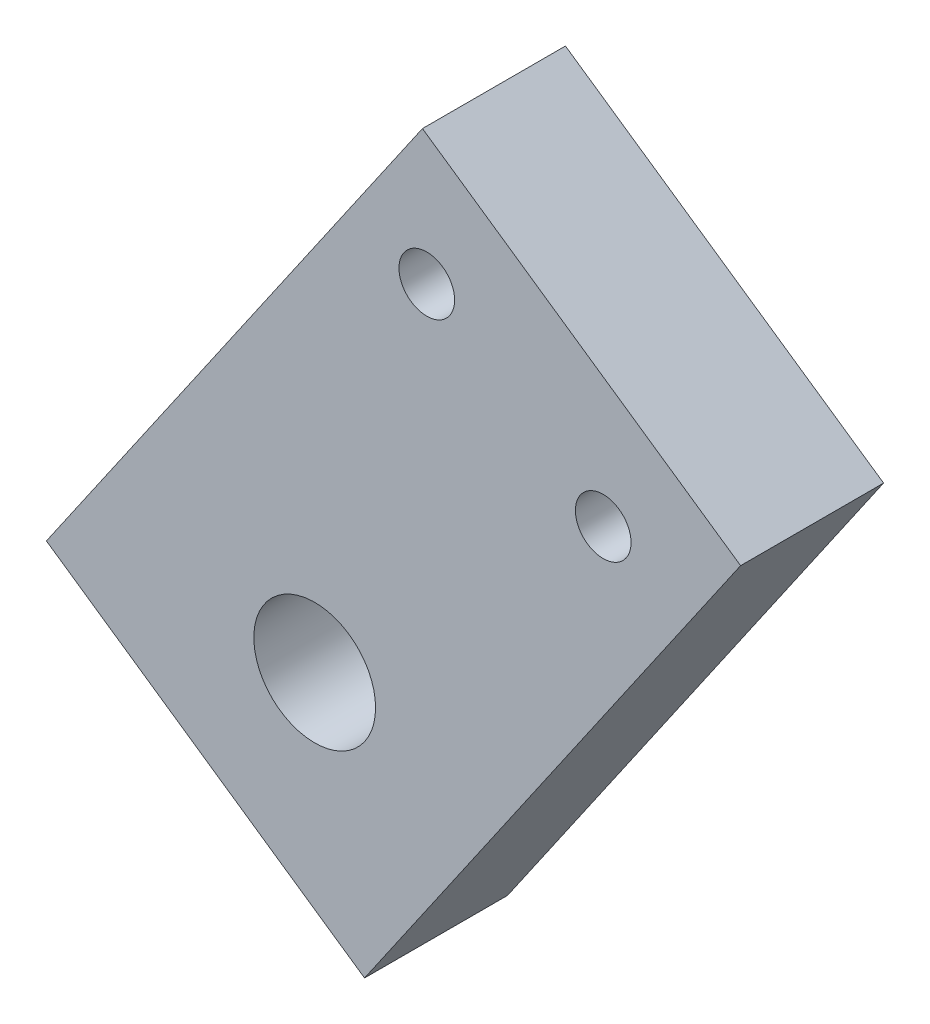
from build123d import *

# Parameters (mm, degrees)
SKETCH1_R           = 4.0005
SKETCH1_R_2         = 1.8288
BOSS_EXTRUDE1_DEPTH = 9.398


with BuildPart() as part:
    # Sketch1 → Boss-Extrude1 (new body)
    with BuildSketch(Plane.XY):
        Polygon((-99.576705368, -106.217941149), (-74.862232988, -70.391150904), (-53.954357906, -84.814075696), (-78.668830286, -120.640865941), align=None)
        with Locations((-81.944997029, -104.896422339)):
            Circle(SKETCH1_R, mode=Mode.SUBTRACT)
        with Locations((-74.578109186, -79.10041322)):
            Circle(SKETCH1_R_2, mode=Mode.SUBTRACT)
        with Locations((-62.982730449, -87.099278471)):
            Circle(SKETCH1_R_2, mode=Mode.SUBTRACT)
    extrude(amount=BOSS_EXTRUDE1_DEPTH)


solid = part.part
